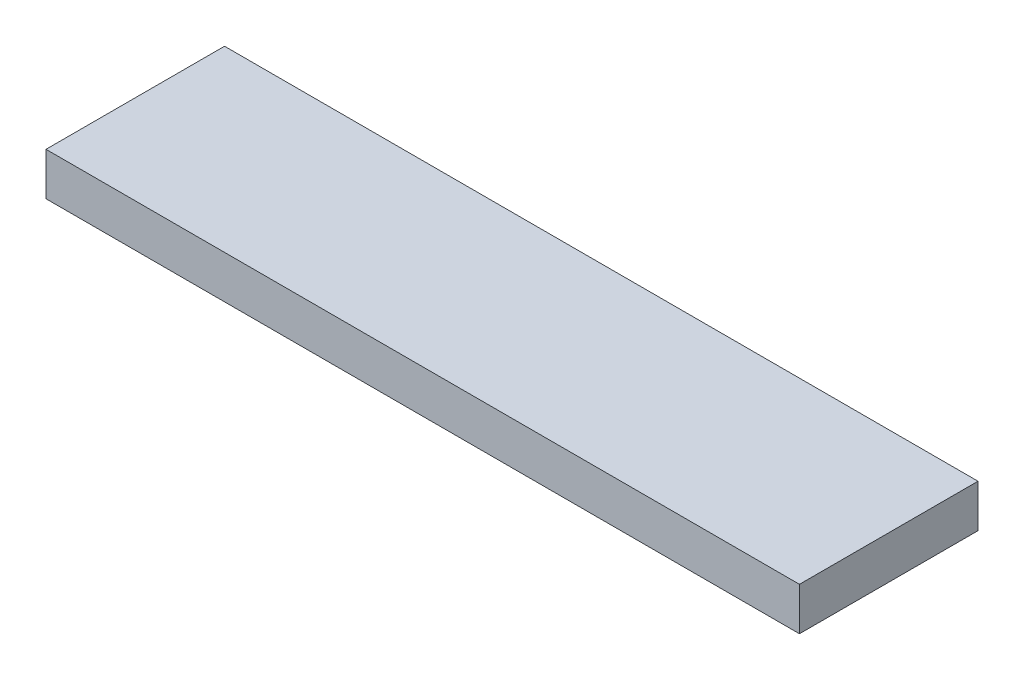
from build123d import *

# Parameters (mm, degrees)
SKETCH_1_W      = 211
SKETCH_1_H      = 50
EXTRUDE_1_DEPTH = 12


with BuildPart() as part:
    # 草图1 → 凸台-拉伸1 (new body)
    with BuildSketch(Plane(origin=(0, 0, 0), x_dir=(1, 0, 0), z_dir=(0, 1, 0))):
        Rectangle(SKETCH_1_W, SKETCH_1_H)
    extrude(amount=EXTRUDE_1_DEPTH)


solid = part.part
